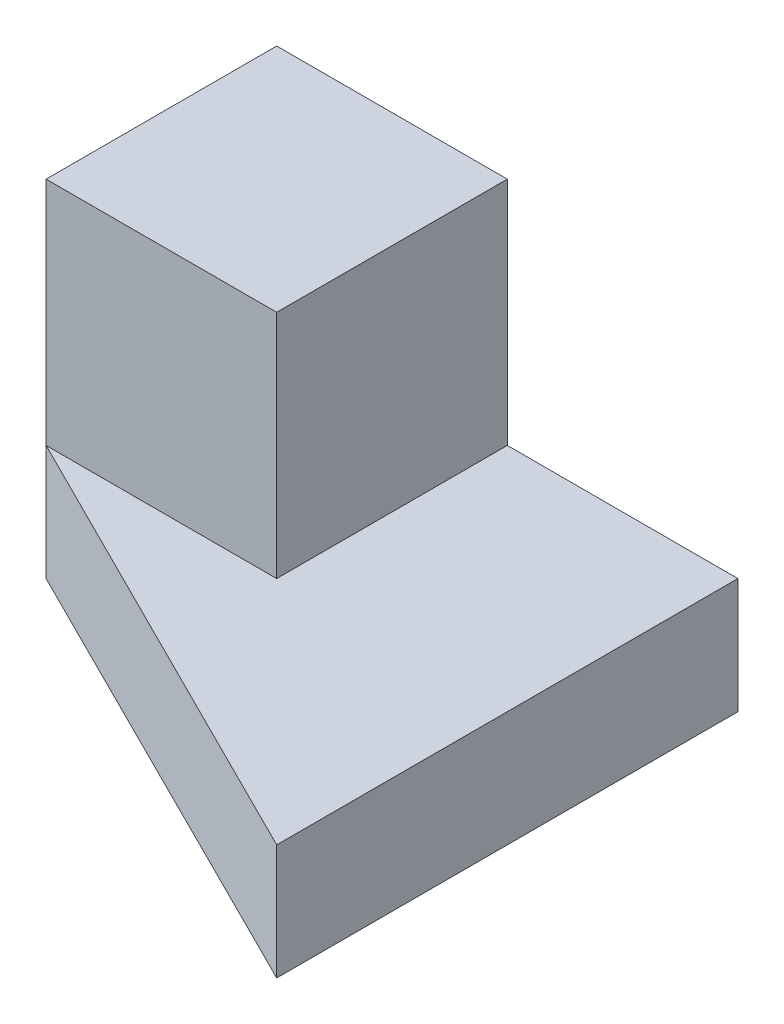
from build123d import *

# Parameters (mm, degrees)
BOSS_EXTRUDE1_DEPTH = 10
SKETCH2_W           = 20
SKETCH2_H           = 20
BOSS_EXTRUDE2_DEPTH = 20


with BuildPart() as part:
    # Sketch1 → Boss-Extrude1 (new body)
    with BuildSketch(Plane(origin=(0, 0, 0), x_dir=(1, 0, 0), z_dir=(0, 1, 0))):
        Polygon((0, 20), (0, -20), (-40, 0), (-40, 20), align=None)
    extrude(amount=BOSS_EXTRUDE1_DEPTH)

    # Sketch2 → Boss-Extrude2 (add)
    with BuildSketch(Plane(origin=(0, 10, 0), x_dir=(1, 0, 0), z_dir=(0, 1, 0))):
        with Locations((-30, 10)):
            Rectangle(SKETCH2_W, SKETCH2_H)
    extrude(amount=BOSS_EXTRUDE2_DEPTH)


solid = part.part
